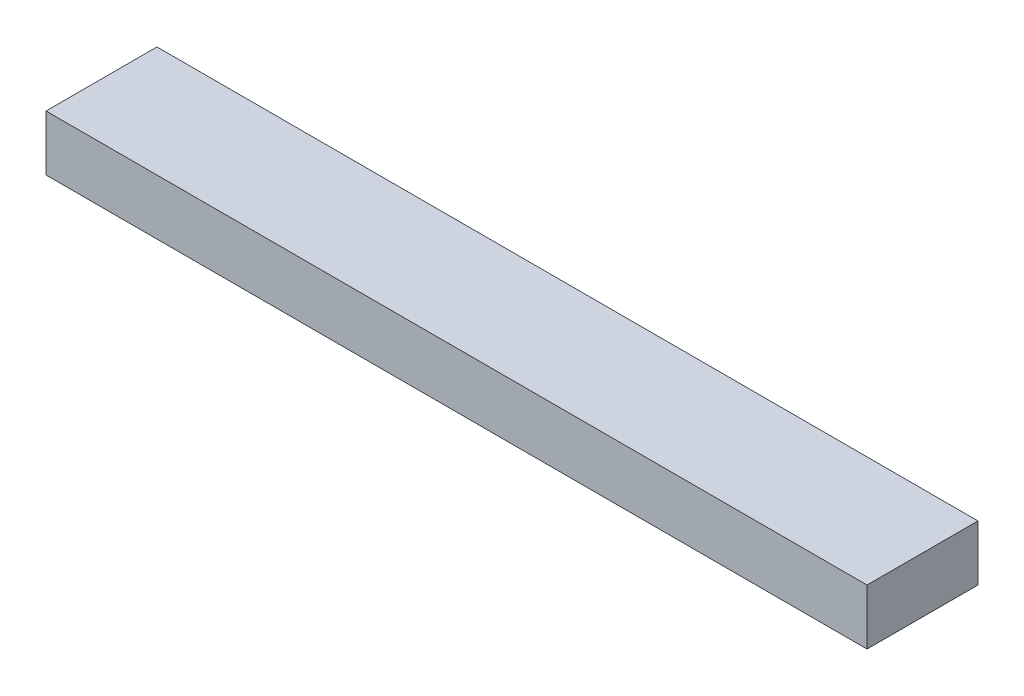
from build123d import *

# Parameters (mm, degrees)
SKETCH1_W           = 46.99
SKETCH1_H           = 6.35
BOSS_EXTRUDE1_DEPTH = 3.175


with BuildPart() as part:
    # Sketch1 → Boss-Extrude1 (new body)
    with BuildSketch(Plane(origin=(0, 0, 0), x_dir=(1, 0, 0), z_dir=(0, 1, 0))):
        Rectangle(SKETCH1_W, SKETCH1_H)
    extrude(amount=BOSS_EXTRUDE1_DEPTH)


solid = part.part
